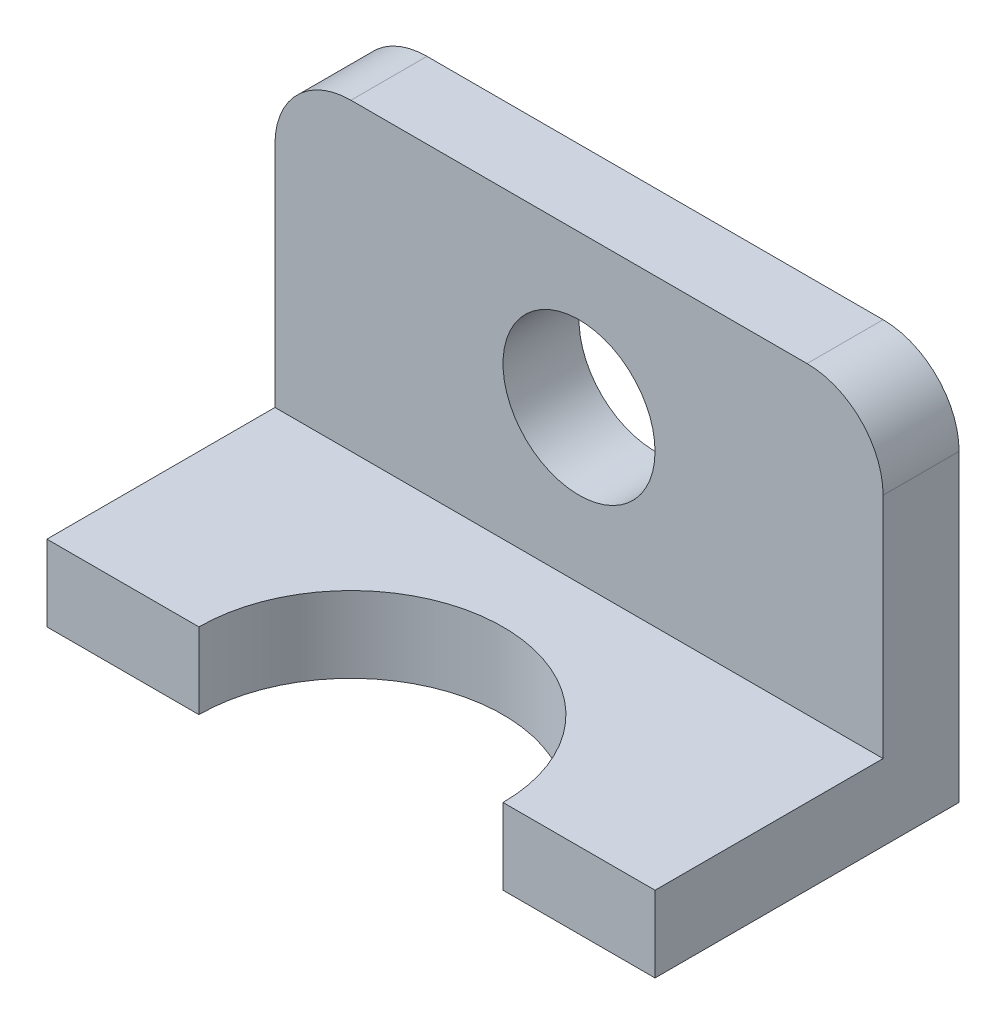
from build123d import *

# Parameters (mm, degrees)
SALIENTE_EXTRUIR1_DEPTH = 101.6
CROQUIS2_R              = 25.4
CORTAR_EXTRUIR1_DEPTH   = 101.6
CROQUIS3_R              = 12.7
CORTAR_EXTRUIR2_DEPTH   = 101.6
REDONDEO1_R             = 12.7


with BuildPart() as part:
    # Croquis1 → Saliente-Extruir1 (new body)
    with BuildSketch(Plane(origin=(0, 0, 0), x_dir=(0, 0, -1), z_dir=(1, 0, 0))):
        Polygon((0, 0), (0, 63.5), (-12.7, 63.5), (-12.7, 12.7), (-50.8, 12.7), (-50.8, 0), align=None)
    extrude(amount=SALIENTE_EXTRUIR1_DEPTH)

    # Croquis2 → Cortar-Extruir1 (cut)
    with BuildSketch(Plane(origin=(0, 12.7, 0), x_dir=(1, 0, 0), z_dir=(0, 1, 0))):
        with Locations((50.8, -50.8)):
            Circle(CROQUIS2_R)
    extrude(amount=-CORTAR_EXTRUIR1_DEPTH, mode=Mode.SUBTRACT)

    # Croquis3 → Cortar-Extruir2 (cut)
    with BuildSketch(Plane.XY.offset(12.7)):
        with Locations((50.8, 38.1)):
            Circle(CROQUIS3_R)
    extrude(amount=-CORTAR_EXTRUIR2_DEPTH, mode=Mode.SUBTRACT)

    # Redondeo1
    redondeo1_edges = [part.edges().sort_by_distance(p)[0] for p in [
        (101.6, 63.5, 6.35),
        (0, 63.5, 6.35),
    ]]
    fillet(redondeo1_edges, radius=REDONDEO1_R)


solid = part.part
